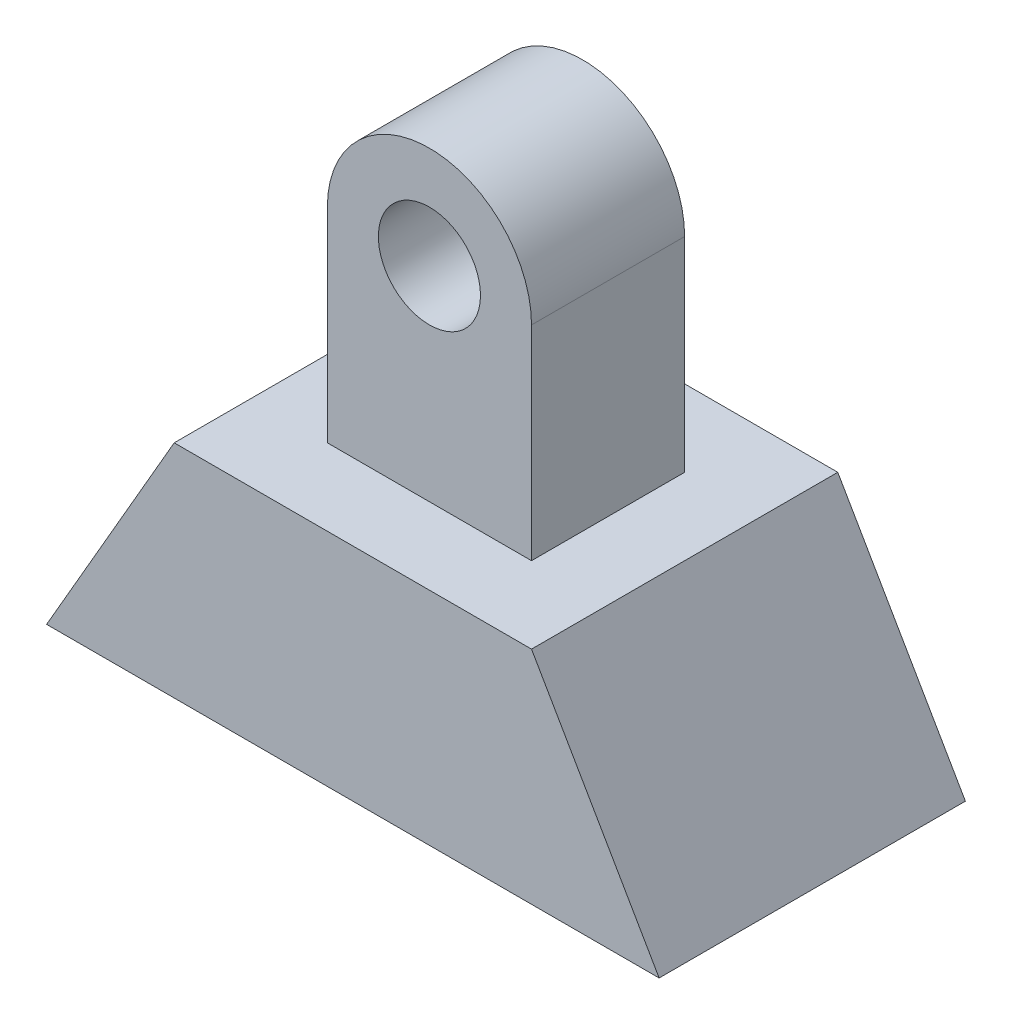
from build123d import *

# Parameters (mm, degrees)
Y_KSEKLIK_EKSTR_ZYON1_DEPTH = 30
IZIM2_R                     = 10
Y_KSEKLIK_EKSTR_ZYON2_DEPTH = 15


with BuildPart() as part:
    # Çizim1 → Yükseklik-Ekstrüzyon1 (new, symmetric)
    with BuildSketch(Plane.XY):
        Polygon((-60, -21.650635095), (60, -21.650635095), (35, 21.650635095), (-35, 21.650635095), align=None)
    extrude(amount=Y_KSEKLIK_EKSTR_ZYON1_DEPTH, both=True)

    # Çizim2 → Yükseklik-Ekstrüzyon2 (add, symmetric)
    with BuildSketch(Plane.XY):
        with BuildLine():
            Line((-20, 21.650635095), (-20, 61.650635095))
            ThreePointArc((-20, 61.650635095), (0, 81.650635095), (20, 61.650635095))
            Line((20, 61.650635095), (20, 21.650635095))
            Line((20, 21.650635095), (-20, 21.650635095))
        make_face()
        with Locations((0, 61.650635095)):
            Circle(IZIM2_R, mode=Mode.SUBTRACT)
    extrude(amount=Y_KSEKLIK_EKSTR_ZYON2_DEPTH, both=True)


solid = part.part
